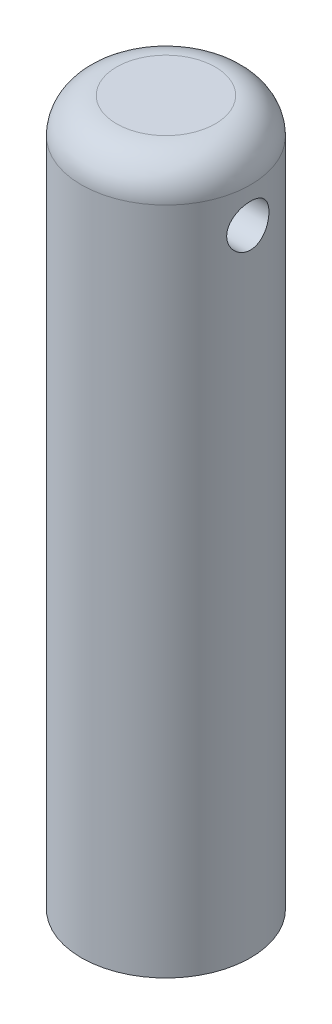
from build123d import *

# Parameters (mm, degrees)
SKETCH_1_R          = 12
SKETCH_1_R_2        = 6
EXTRUDE_1_DEPTH     = 80
CUT_EXTRUDE_1_DEPTH = 17
FILLET_1_R          = 1
SKETCH_3_R          = 12
EXTRUDE_2_DEPTH     = 20
FILLET_2_R          = 5
SKETCH_4_R          = 3
CUT_EXTRUDE_3_DEPTH = 22.5


with BuildPart() as part:
    # Эскиз1 → Вытянуть1 (new body)
    with BuildSketch(Plane(origin=(0, 0, 0), x_dir=(1, 0, 0), z_dir=(0, 1, 0))):
        with Locations(Location((0, 0, 0), (0, 0, 270))):
            Circle(SKETCH_1_R)
        with Locations(Location((0, 0, 0), (0, 0, 270))):
            Circle(SKETCH_1_R_2, mode=Mode.SUBTRACT)
    extrude(amount=EXTRUDE_1_DEPTH)

    # Эскиз2 → Вырез-Вытянуть1 (cut)
    with BuildSketch(Plane.XZ):
        Polygon((6.883625854, -3.933459236), (6.84828855, 3.994665242), (-0.035337304, 7.928124478), (-6.883625854, 3.933459236), (-6.84828855, -3.994665242), (0.035337304, -7.928124478), align=None)
    extrude(amount=-CUT_EXTRUDE_1_DEPTH, mode=Mode.SUBTRACT)

    # Скругление1
    fillet_1_edges = [part.edges().sort_by_distance(p)[0] for p in [
        (6.883625854, 8.5, -3.933459236),
        (0.035337304, 8.5, -7.928124478),
        (-6.84828855, 8.5, -3.994665242),
        (-6.883625854, 8.5, 3.933459236),
        (-0.035337304, 8.5, 7.928124478),
        (6.84828855, 8.5, 3.994665242),
    ]]
    fillet(fillet_1_edges, radius=FILLET_1_R)

    # Эскиз3 → Вытянуть2 (add)
    with BuildSketch(Plane(origin=(0, 80, 0), x_dir=(1, 0, 0), z_dir=(0, 1, 0))):
        with Locations(Location((0, 0, 0), (0, 0, 270))):
            Circle(SKETCH_3_R)
    extrude(amount=EXTRUDE_2_DEPTH)

    # Скругление2
    fillet_2_edges = [part.edges().sort_by_distance(p)[0] for p in [
        (0, 100, -12),
    ]]
    fillet(fillet_2_edges, radius=FILLET_2_R)

    # Эскиз4 → Вытянуть3 (cut, symmetric)
    with BuildSketch(Plane(origin=(0, 0, 0), x_dir=(0, 0, -1), z_dir=(1, 0, 0))):
        with Locations((0, 90)):
            Circle(SKETCH_4_R)
    extrude(amount=CUT_EXTRUDE_3_DEPTH, both=True, mode=Mode.SUBTRACT)


solid = part.part
